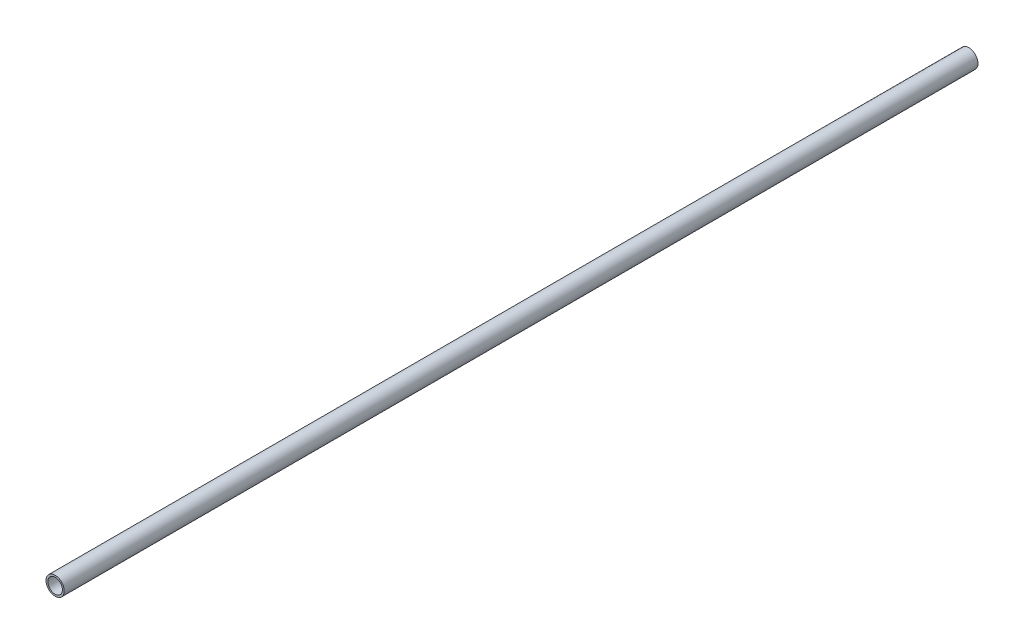
from build123d import *

# Parameters (mm, degrees)
SZKIC1_R                    = 5
DODANIE_WYCI_GNI_CIE1_DEPTH = 500
SZKIC2_R                    = 4
WYTNIJ_WYCI_GNI_CIE1_DEPTH  = 500


with BuildPart() as part:
    # Szkic1 → Dodanie-wyciągnięcie1 (new body)
    with BuildSketch(Plane.XY):
        Circle(SZKIC1_R)
    extrude(amount=DODANIE_WYCI_GNI_CIE1_DEPTH)

    # Szkic2 → Wytnij-wyciągnięcie1 (cut)
    with BuildSketch(Plane.XY.offset(500)):
        Circle(SZKIC2_R)
    extrude(amount=-WYTNIJ_WYCI_GNI_CIE1_DEPTH, mode=Mode.SUBTRACT)


solid = part.part
